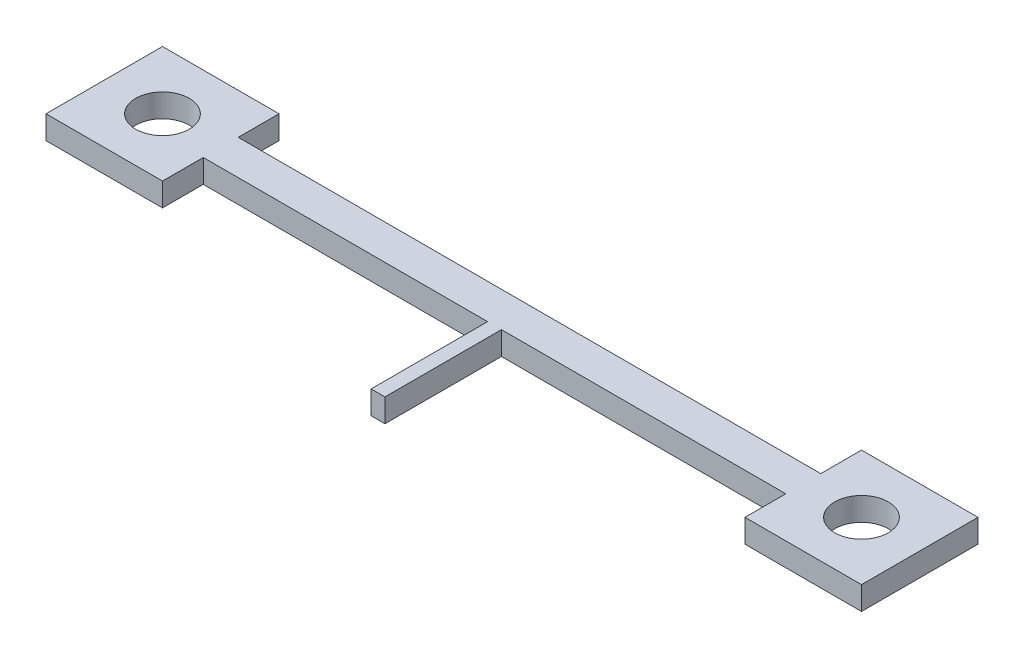
from build123d import *

# Parameters (mm, degrees)
BOSS_EXTRUDE1_DEPTH          = 0.635
F_97_0_0059_DIAMETER_HOLE1_D = 2.921
SKETCH7_W                    = 0.500000016
SKETCH7_H                    = 1.27
BOSS_EXTRUDE2_DEPTH          = 6.35
SKETCH11_W                   = 6.35
SKETCH11_H                   = 1.27
BOSS_EXTRUDE3_DEPTH          = 0.127
SKETCH12_W                   = 6.35
SKETCH12_H                   = 1.27
BOSS_EXTRUDE4_DEPTH          = 0.127


with BuildPart() as part:
    # Sketch1 → Boss-Extrude1 (new, symmetric)
    with BuildSketch(Plane(origin=(0, 0, 0), x_dir=(1, 0, 0), z_dir=(0, 1, 0))):
        Polygon((-41.424046485, -10.283259465), (-41.424046485, -12.505759465), (-47.774046485, -12.505759465), (-47.774046485, -6.155759465), (-41.424046485, -6.155759465), (-41.424046485, -8.378259465), (-9.674046485, -8.378259465), (-9.674046485, -6.155759465), (-3.324046485, -6.155759465), (-3.324046485, -12.505759465), (-9.674046485, -12.505759465), (-9.674046485, -10.283259465), align=None)
    extrude(amount=BOSS_EXTRUDE1_DEPTH, both=True)

    # #97 (0.0059) Diameter Hole1 (through all)
    with Locations(Plane(origin=(0, 0.635, 0), x_dir=(-1, 0, 0), z_dir=(0, 1, 0))):
        with Locations((44.599046485, 9.330759465)):
            f_97_0_0059_diameter_hole1 = Hole(F_97_0_0059_DIAMETER_HOLE1_D / 2)

    # Mirror1: #97 (0.0059) Diameter Hole1 across plane
    add(f_97_0_0059_diameter_hole1.mirror(Plane(origin=(-25.549046485, 0, 0), x_dir=(0, 0, 1), z_dir=(1, 0, 0))), mode=Mode.SUBTRACT)

    # Sketch7 → Boss-Extrude2 (add)
    with BuildSketch(Plane.XY.offset(10.283259465)):
        with Locations((-25.549046485, 0)):
            Rectangle(SKETCH7_W, SKETCH7_H)
    extrude(amount=BOSS_EXTRUDE2_DEPTH)

    # Sketch11 → Boss-Extrude3 (add)
    with BuildSketch(Plane.ZY.offset(25.799046493)):
        with Locations((13.458259465, 0)):
            Rectangle(SKETCH11_W, SKETCH11_H)
    extrude(amount=BOSS_EXTRUDE3_DEPTH)

    # Sketch12 → Boss-Extrude4 (add)
    with BuildSketch(Plane(origin=(-25.299046477, 0, 0), x_dir=(0, 0, -1), z_dir=(1, 0, 0))):
        with Locations((-13.458259465, 0)):
            Rectangle(SKETCH12_W, SKETCH12_H)
    extrude(amount=BOSS_EXTRUDE4_DEPTH)


solid = part.part
